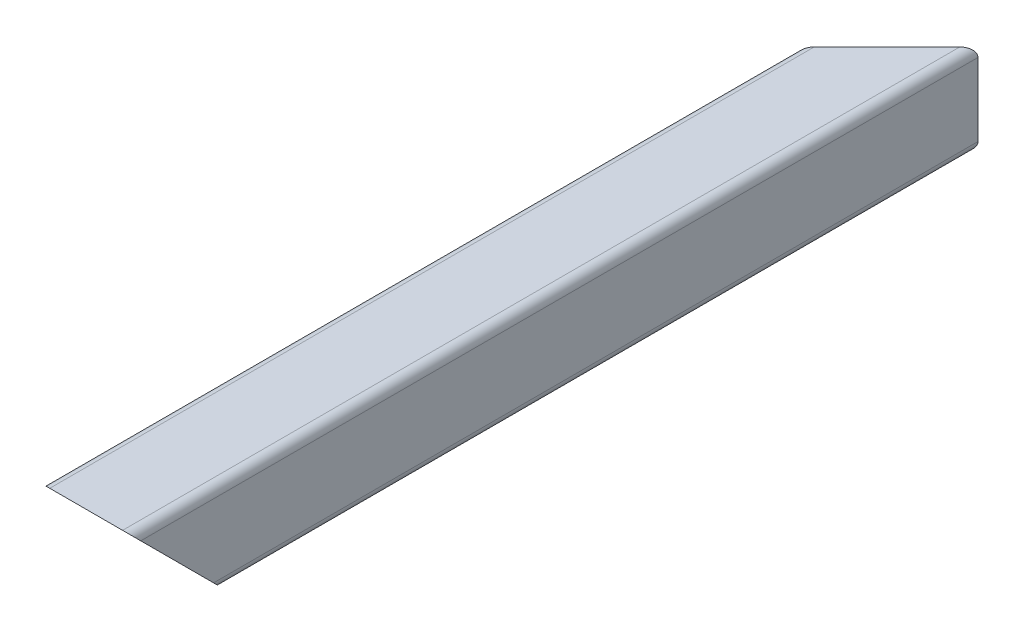
from build123d import *

# Parameters (mm, degrees)
Y_KSEKLIK_EKSTR_ZYON1_DEPTH = 372
KES_EKSTR_ZYON1_DEPTH       = 41
KES_EKSTR_ZYON1_DEPTH_BACK  = 43
KES_EKSTR_ZYON2_DEPTH       = 72
KES_EKSTR_ZYON2_DEPTH_BACK  = 61


with BuildPart() as part:
    # Çizim1 → Yükseklik-Ekstrüzyon1 (new body)
    with BuildSketch(Plane.XY):
        with BuildLine():
            Line((-16, 20), (16, 20))
            ThreePointArc((16, 20), (18.828427125, 18.828427125), (20, 16))
            Line((20, 16), (20, -16))
            ThreePointArc((20, -16), (18.828427125, -18.828427125), (16, -20))
            Line((16, -20), (-16, -20))
            ThreePointArc((-16, -20), (-18.828427125, -18.828427125), (-20, -16))
            Line((-20, -16), (-20, 16))
            ThreePointArc((-20, 16), (-18.828427125, 18.828427125), (-16, 20))
        make_face()
        with BuildLine():
            Line((-18, 16), (-18, -16))
            ThreePointArc((-18, -16), (-17.414213562, -17.414213562), (-16, -18))
            Line((-16, -18), (16, -18))
            ThreePointArc((16, -18), (17.414213562, -17.414213562), (18, -16))
            Line((18, -16), (18, 16))
            ThreePointArc((18, 16), (17.414213562, 17.414213562), (16, 18))
            Line((16, 18), (-16, 18))
            ThreePointArc((-16, 18), (-17.414213562, 17.414213562), (-18, 16))
        make_face(mode=Mode.SUBTRACT)
    extrude(amount=Y_KSEKLIK_EKSTR_ZYON1_DEPTH)

    # Çizim3 → Kes-Ekstrüzyon1 (cut, two sides: drawn at the far end of the back side and taken through both)
    with BuildSketch(Plane(origin=(0, 0, 0), x_dir=(0, 0, -1), z_dir=(1, 0, 0)).offset(-KES_EKSTR_ZYON1_DEPTH_BACK)):
        Polygon((-372, 20), (-332, -20), (-372, -20), align=None)
    extrude(amount=KES_EKSTR_ZYON1_DEPTH + KES_EKSTR_ZYON1_DEPTH_BACK, mode=Mode.SUBTRACT)

    # Çizim5 → Kes-Ekstrüzyon2 (cut, two sides: drawn at the far end of the back side and taken through both)
    with BuildSketch(Plane(origin=(0, 0, 0), x_dir=(1, 0, 0), z_dir=(0, 1, 0)).offset(-KES_EKSTR_ZYON2_DEPTH_BACK)):
        Polygon((20, 0), (-20, -40), (-20, 0), align=None)
    extrude(amount=KES_EKSTR_ZYON2_DEPTH + KES_EKSTR_ZYON2_DEPTH_BACK, mode=Mode.SUBTRACT)


solid = part.part
